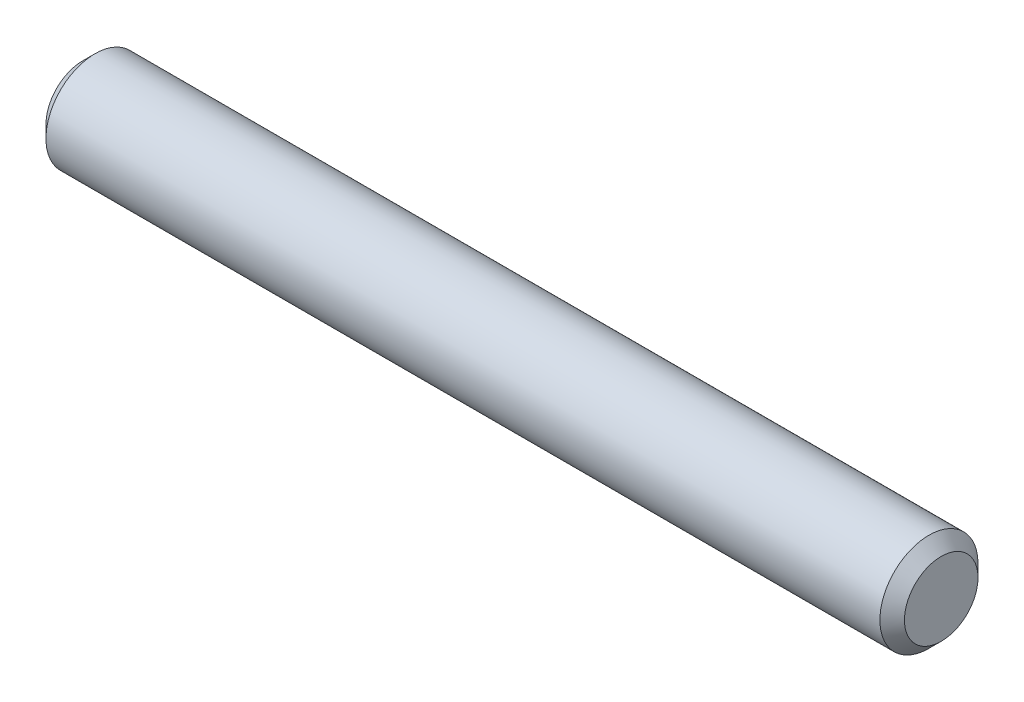
from build123d import *

# Parameters (mm, degrees)
SCHIZZO1_R                   = 4
ESTRUSIONE_ESTRUSIONE1_DEPTH = 70
SMUSSO1_SIZE                 = 1


with BuildPart() as part:
    # Schizzo1 → Estrusione-Estrusione1 (new body)
    with BuildSketch(Plane(origin=(0, 0, 0), x_dir=(0, 0, -1), z_dir=(1, 0, 0))):
        Circle(SCHIZZO1_R)
    extrude(amount=ESTRUSIONE_ESTRUSIONE1_DEPTH)

    # Smusso1
    smusso1_edges = [part.edges().sort_by_distance(p)[0] for p in [
        (0, 0, 4),
        (70, 0, 4),
    ]]
    chamfer(smusso1_edges, length=SMUSSO1_SIZE)


solid = part.part
